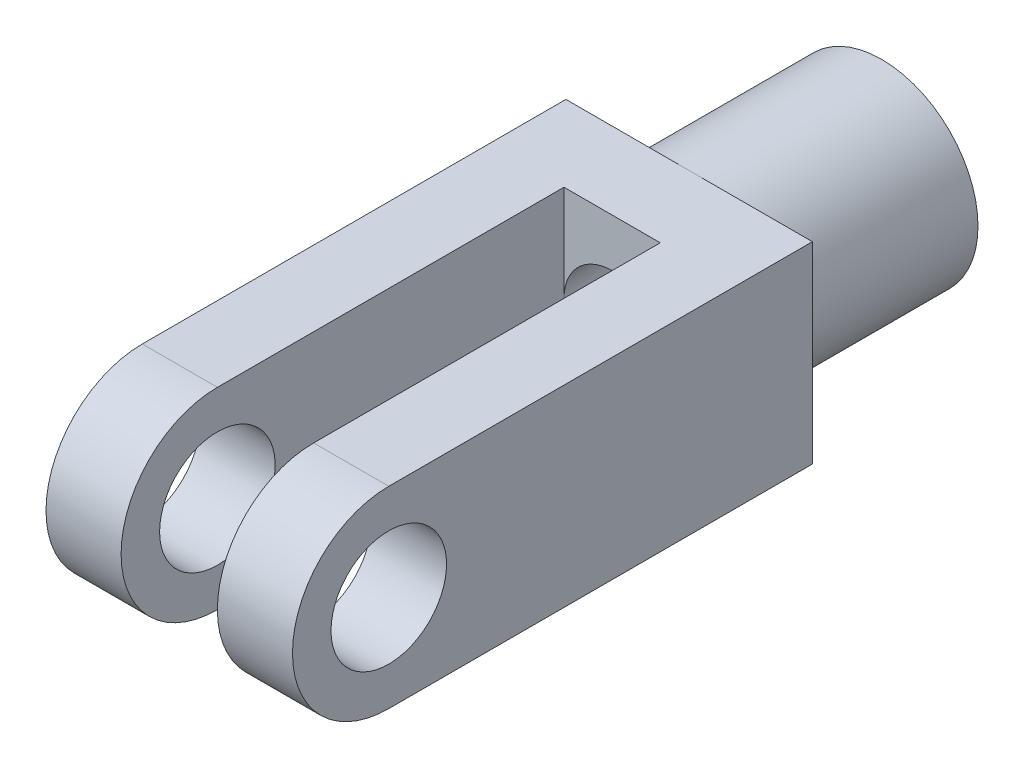
from build123d import *

# Parameters (mm, degrees)
SKETCH1_R           = 2.5
SKETCH1_R_2         = 1.5
BOSS_EXTRUDE1_DEPTH = 5
SKETCH2_W           = 6.4
SKETCH2_H           = 5
BOSS_EXTRUDE2_DEPTH = 13.5
SKETCH3_W           = 2.5
SKETCH3_H           = 5
CUT_EXTRUDE1_DEPTH  = 11.5
SKETCH4_R           = 1.5
CUT_EXTRUDE2_DEPTH  = 7
SKETCH_2_R          = 1.25
CUT_EXTRUDE_1_DEPTH = 10


with BuildPart() as part:
    # Sketch1 → Boss-Extrude1 (new body)
    with BuildSketch(Plane.XY):
        Circle(SKETCH1_R)
        Circle(SKETCH1_R_2, mode=Mode.SUBTRACT)
    extrude(amount=BOSS_EXTRUDE1_DEPTH)

    # Sketch2 → Boss-Extrude2 (add)
    with BuildSketch(Plane.XY.offset(5)):
        Rectangle(SKETCH2_W, SKETCH2_H)
    extrude(amount=BOSS_EXTRUDE2_DEPTH)

    # Sketch3 → Cut-Extrude1 (cut)
    with BuildSketch(Plane.XY.offset(18.5)):
        Rectangle(SKETCH3_W, SKETCH3_H)
    extrude(amount=-CUT_EXTRUDE1_DEPTH, mode=Mode.SUBTRACT)

    # Sketch4 → Cut-Extrude2 (cut)
    with BuildSketch(Plane.ZY.offset(3.2)):
        with Locations((16, 0)):
            Circle(SKETCH4_R)
        with BuildLine():
            Line((16, 2.5), (20, 2.5))
            Line((20, 2.5), (20, -2.5))
            Line((20, -2.5), (16, -2.5))
            ThreePointArc((16, -2.5), (18.5, 0), (16, 2.5))
        make_face()
    extrude(amount=-CUT_EXTRUDE2_DEPTH, mode=Mode.SUBTRACT)

    # 草图2 → 切除-拉伸1 (cut)
    with BuildSketch(Plane(origin=(0, 0, 5), x_dir=(-1, 0, 0), z_dir=(0, 0, -1))):
        Circle(SKETCH_2_R)
    extrude(amount=-CUT_EXTRUDE_1_DEPTH, mode=Mode.SUBTRACT)


solid = part.part
